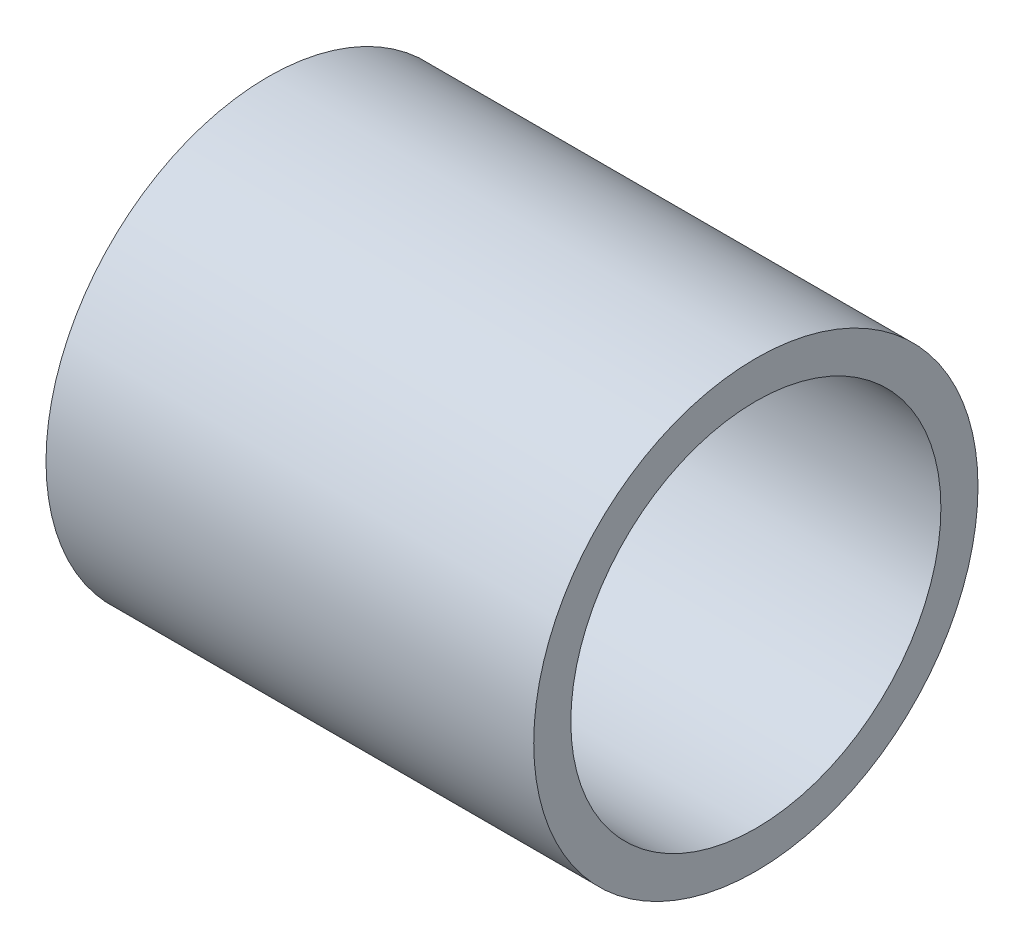
from build123d import *

# Parameters (mm, degrees)
SKETCH1_R           = 3.18135
SKETCH1_R_2         = 2.65
BOSS_EXTRUDE1_DEPTH = 3.4925


with BuildPart() as part:
    # Sketch1 → Boss-Extrude1 (new, symmetric)
    with BuildSketch(Plane(origin=(0, 0, 0), x_dir=(0, 0, -1), z_dir=(1, 0, 0))):
        Circle(SKETCH1_R)
        Circle(SKETCH1_R_2, mode=Mode.SUBTRACT)
    extrude(amount=BOSS_EXTRUDE1_DEPTH, both=True)


solid = part.part
